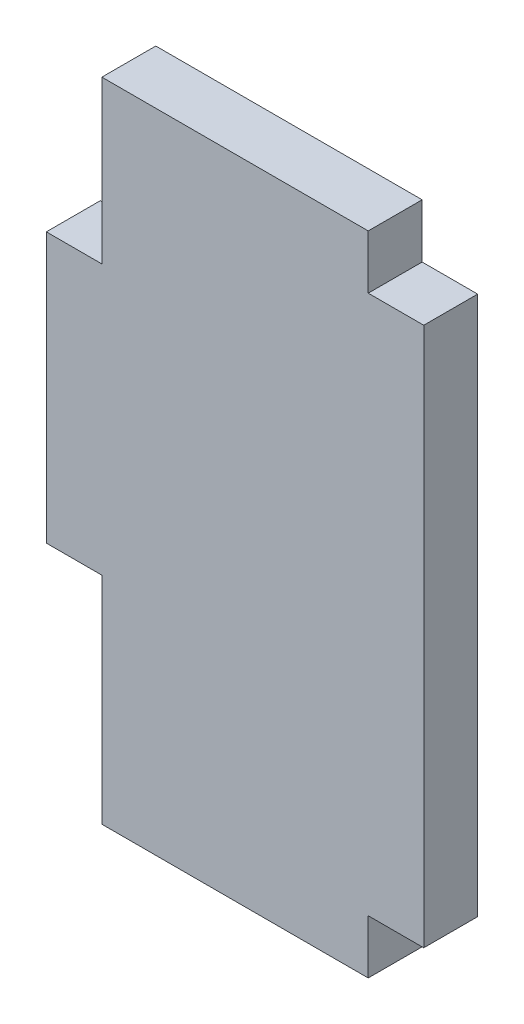
from build123d import *

# Parameters (mm, degrees)
BOSS_EXTRUDE1_DEPTH = 5


with BuildPart() as part:
    # Sketch1 → Boss-Extrude1 (new body)
    with BuildSketch(Plane.XY):
        Polygon((-5.15, 45), (0, 45), (0, 60), (24.7, 60), (24.7, 55), (29.85, 55), (29.85, 5), (24.7, 5), (24.7, 0), (0, 0), (0, 20), (-5.15, 20), align=None)
    extrude(amount=BOSS_EXTRUDE1_DEPTH)


solid = part.part
